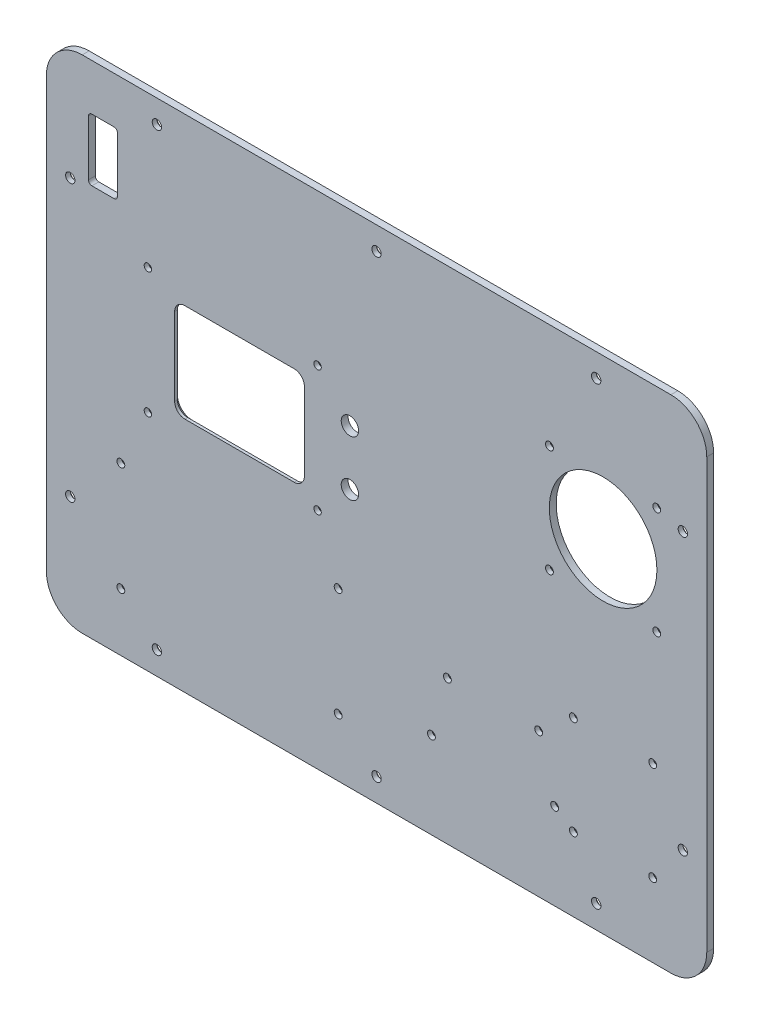
from build123d import *

# Parameters (mm, degrees)
BOSS_EXTRUDE1_DEPTH             = 3.175
F_6_CLEARANCE_HOLE1_AT_2_COUNT  = 2
F_6_CLEARANCE_HOLE1_AT_2_PITCH  = 202.184
F_6_CLEARANCE_HOLE1_AT_3_COUNT  = 2
F_6_CLEARANCE_HOLE1_AT_3_PITCH  = 245.533205315
F_6_CLEARANCE_HOLE1_AT_4_COUNT  = 2
F_6_CLEARANCE_HOLE1_AT_4_PITCH  = 294.732330958
F_6_CLEARANCE_HOLE1_AT_5_COUNT  = 2
F_6_CLEARANCE_HOLE1_AT_5_PITCH  = 209.296
F_6_CLEARANCE_HOLE1_AT_6_COUNT  = 2
F_6_CLEARANCE_HOLE1_AT_6_PITCH  = 172.811757411
F_6_CLEARANCE_HOLE1_AT_7_COUNT  = 2
F_6_CLEARANCE_HOLE1_AT_7_PITCH  = 57.300187604
F_6_CLEARANCE_HOLE1_AT_8_COUNT  = 2
F_6_CLEARANCE_HOLE1_AT_8_PITCH  = 291.003755082
F_6_CLEARANCE_HOLE1_AT_9_COUNT  = 2
F_6_CLEARANCE_HOLE1_AT_9_PITCH  = 232.431512666
F_6_CLEARANCE_HOLE1_AT_10_COUNT = 2
F_6_CLEARANCE_HOLE1_AT_10_PITCH = 101.092
SKETCH23_R                      = 24.765
CUT_EXTRUDE10_DEPTH             = 191.76187976
SKETCH24_W                      = 59.69
SKETCH24_H                      = 45.212
CUT_EXTRUDE11_DEPTH             = 191.76187976
FILLET2_R                       = 4.699
CHAMFER1_SIZE                   = 1.905
M3_CLEARANCE_HOLE3_AT_2_COUNT   = 2
M3_CLEARANCE_HOLE3_AT_2_PITCH   = 49.391408666
M3_CLEARANCE_HOLE3_AT_3_COUNT   = 2
M3_CLEARANCE_HOLE3_AT_3_PITCH   = 69.85
M3_CLEARANCE_HOLE3_AT_4_COUNT   = 2
M3_CLEARANCE_HOLE3_AT_4_PITCH   = 49.391408666
M3_CLEARANCE_HOLE1_D            = 3.6
M3_CLEARANCE_HOLE1_CSINK_D      = 5.7
M3_CLEARANCE_HOLE1_CSINK_ANGLE  = 90
M3_CLEARANCE_HOLE2_AT_2_COUNT   = 2
M3_CLEARANCE_HOLE2_AT_2_PITCH   = 56.70042
M3_CLEARANCE_HOLE2_AT_3_COUNT   = 2
M3_CLEARANCE_HOLE2_AT_3_PITCH   = 102.00589147
M3_CLEARANCE_HOLE2_AT_4_COUNT   = 2
M3_CLEARANCE_HOLE2_AT_4_PITCH   = 109.267844742
M3_CLEARANCE_HOLE2_AT_5_COUNT   = 2
M3_CLEARANCE_HOLE2_AT_5_PITCH   = 65.600653918
M3_CLEARANCE_HOLE2_AT_6_COUNT   = 2
M3_CLEARANCE_HOLE2_AT_6_PITCH   = 76.404880698
M3_CLEARANCE_HOLE2_AT_7_COUNT   = 2
M3_CLEARANCE_HOLE2_AT_7_PITCH   = 27.404059918
M3_CLEARANCE_HOLE2_AT_8_COUNT   = 2
M3_CLEARANCE_HOLE2_AT_8_PITCH   = 55.968061912
SKETCH35_W                      = 13.335
SKETCH35_H                      = 28.575
CUT_EXTRUDE12_DEPTH             = 191.76187976
FILLET1_R                       = 1.5875
F_8_0MM_DOWEL_HOLE1_D           = 8
M3_CLEARANCE_HOLE4_AT_2_COUNT   = 2
M3_CLEARANCE_HOLE4_AT_2_PITCH   = 78.105
M3_CLEARANCE_HOLE4_AT_3_COUNT   = 2
M3_CLEARANCE_HOLE4_AT_3_PITCH   = 97.157075141
M3_CLEARANCE_HOLE4_AT_4_COUNT   = 2
M3_CLEARANCE_HOLE4_AT_4_PITCH   = 57.785


with BuildPart() as part:
    # Sketch1 → Boss-Extrude1 (new body)
    with BuildSketch(Plane.XY):
        with BuildLine():
            Line((-151.96693, 98.7552), (-151.96693, -98.7552))
            ThreePointArc((-151.96693, -98.7552), (-147.131262957, -110.429532957), (-135.45693, -115.2652))
            Line((-135.45693, -115.2652), (135.45693, -115.2652))
            ThreePointArc((135.45693, -115.2652), (147.131262957, -110.429532957), (151.96693, -98.7552))
            Line((151.96693, -98.7552), (151.96693, 98.7552))
            ThreePointArc((151.96693, 98.7552), (147.131262957, 110.429532957), (135.45693, 115.2652))
            Line((135.45693, 115.2652), (-135.45693, 115.2652))
            ThreePointArc((-135.45693, 115.2652), (-147.131262957, 110.429532957), (-151.96693, 98.7552))
        make_face()
    extrude(amount=-BOSS_EXTRUDE1_DEPTH)

    # Sketch3 → #6 Clearance Hole1 (revolve, cut)
    with BuildSketch(Plane(origin=(101.092, 104.648, 0), x_dir=(0, -1, 0), z_dir=(1, 0, 0))):
        Polygon((0, 0), (0, 3.175), (3.3655, 3.175), (2.15265, 2.157298012), (2.15265, 0), align=None)
    f_6_clearance_hole1 = revolve(axis=Axis((101.092, 104.648, 6.35), (0, 0, -1)), mode=Mode.SUBTRACT)

    # #6 Clearance Hole1 at 2: #6 Clearance Hole1 ×2
    with Locations(*[(-i * F_6_CLEARANCE_HOLE1_AT_2_PITCH, 0, 0) for i in range(1, F_6_CLEARANCE_HOLE1_AT_2_COUNT)]):
        add(f_6_clearance_hole1, mode=Mode.SUBTRACT)

    # #6 Clearance Hole1 at 3: #6 Clearance Hole1 ×2
    with Locations(*[Vector(-0.9858574105677721, -0.1675862942743448, 0) * (i * F_6_CLEARANCE_HOLE1_AT_3_PITCH) for i in range(1, F_6_CLEARANCE_HOLE1_AT_3_COUNT)]):
        add(f_6_clearance_hole1, mode=Mode.SUBTRACT)

    # #6 Clearance Hole1 at 4: #6 Clearance Hole1 ×2
    with Locations(*[Vector(-0.8212900471859665, -0.5705108749123656, 0) * (i * F_6_CLEARANCE_HOLE1_AT_4_PITCH) for i in range(1, F_6_CLEARANCE_HOLE1_AT_4_COUNT)]):
        add(f_6_clearance_hole1, mode=Mode.SUBTRACT)

    # #6 Clearance Hole1 at 5: #6 Clearance Hole1 ×2
    with Locations(*[(0, -i * F_6_CLEARANCE_HOLE1_AT_5_PITCH, 0) for i in range(1, F_6_CLEARANCE_HOLE1_AT_5_COUNT)]):
        add(f_6_clearance_hole1, mode=Mode.SUBTRACT)

    # #6 Clearance Hole1 at 6: #6 Clearance Hole1 ×2
    with Locations(*[Vector(0.23075241289949347, -0.9730124993755537, 0) * (i * F_6_CLEARANCE_HOLE1_AT_6_PITCH) for i in range(1, F_6_CLEARANCE_HOLE1_AT_6_COUNT)]):
        add(f_6_clearance_hole1, mode=Mode.SUBTRACT)

    # #6 Clearance Hole1 at 7: #6 Clearance Hole1 ×2
    with Locations(*[Vector(0.6959266918172804, -0.7181128320927402, 0) * (i * F_6_CLEARANCE_HOLE1_AT_7_PITCH) for i in range(1, F_6_CLEARANCE_HOLE1_AT_7_COUNT)]):
        add(f_6_clearance_hole1, mode=Mode.SUBTRACT)

    # #6 Clearance Hole1 at 8: #6 Clearance Hole1 ×2
    with Locations(*[Vector(-0.6947814125038304, -0.719220959677332, 0) * (i * F_6_CLEARANCE_HOLE1_AT_8_PITCH) for i in range(1, F_6_CLEARANCE_HOLE1_AT_8_COUNT)]):
        add(f_6_clearance_hole1, mode=Mode.SUBTRACT)

    # #6 Clearance Hole1 at 9: #6 Clearance Hole1 ×2
    with Locations(*[Vector(-0.4349324187613887, -0.9004630981391565, 0) * (i * F_6_CLEARANCE_HOLE1_AT_9_PITCH) for i in range(1, F_6_CLEARANCE_HOLE1_AT_9_COUNT)]):
        add(f_6_clearance_hole1, mode=Mode.SUBTRACT)

    # #6 Clearance Hole1 at 10: #6 Clearance Hole1 ×2
    with Locations(*[(-i * F_6_CLEARANCE_HOLE1_AT_10_PITCH, 0, 0) for i in range(1, F_6_CLEARANCE_HOLE1_AT_10_COUNT)]):
        add(f_6_clearance_hole1, mode=Mode.SUBTRACT)

    # Sketch23 → Cut-Extrude10 (cut, through all)
    with BuildSketch(Plane.XY):
        with Locations((104.26573, 42.164)):
            Circle(SKETCH23_R)
    extrude(amount=-CUT_EXTRUDE10_DEPTH, mode=Mode.SUBTRACT)

    # Sketch24 → Cut-Extrude11 (cut, through all)
    with BuildSketch(Plane.XY):
        with Locations((-63.06693, 16.31442)):
            Rectangle(SKETCH24_W, SKETCH24_H)
    extrude(amount=-CUT_EXTRUDE11_DEPTH, mode=Mode.SUBTRACT)

    # Fillet2
    fillet2_edges = [part.edges().sort_by_distance(p)[0] for p in [
        (-92.91193, -6.29158, -1.5875),
        (-92.91193, 38.92042, -1.5875),
        (-33.22193, 38.92042, -1.5875),
        (-33.22193, -6.29158, -1.5875),
    ]]
    fillet(fillet2_edges, radius=FILLET2_R)

    # Chamfer1
    chamfer1_edges = [part.edges().sort_by_distance(p)[0] for p in [
        (-33.22193, 16.31442, -3.175),
        (-63.06693, -6.29158, -3.175),
        (-92.91193, 16.31442, -3.175),
        (-63.06693, 38.92042, -3.175),
        (-34.598235235, -4.915274765, -3.175),
        (-91.535624765, -4.915274765, -3.175),
        (-91.535624765, 37.544114765, -3.175),
        (-34.598235235, 37.544114765, -3.175),
    ]]
    chamfer(chamfer1_edges, length=CHAMFER1_SIZE)

    # Sketch30 → M3 Clearance Hole3 (revolve, cut)
    with BuildSketch(Plane(origin=(79.570025667, 66.859704333, 0), x_dir=(0, -1, 0), z_dir=(1, 0, 0))):
        Polygon((0, 0), (0, 3.175), (2.85, 3.175), (1.8, 2.125), (1.8, 0), align=None)
    m3_clearance_hole3 = revolve(axis=Axis((79.570025667, 66.859704333, 6.35), (0, 0, -1)), mode=Mode.SUBTRACT)

    # M3 Clearance Hole3 at 2: M3 Clearance Hole3 ×2
    with Locations(*[(i * M3_CLEARANCE_HOLE3_AT_2_PITCH, 0, 0) for i in range(1, M3_CLEARANCE_HOLE3_AT_2_COUNT)]):
        add(m3_clearance_hole3, mode=Mode.SUBTRACT)

    # M3 Clearance Hole3 at 3: M3 Clearance Hole3 ×2
    with Locations(*[Vector(0.7071067811865477, -0.7071067811865475, 0) * (i * M3_CLEARANCE_HOLE3_AT_3_PITCH) for i in range(1, M3_CLEARANCE_HOLE3_AT_3_COUNT)]):
        add(m3_clearance_hole3, mode=Mode.SUBTRACT)

    # M3 Clearance Hole3 at 4: M3 Clearance Hole3 ×2
    with Locations(*[(0, -i * M3_CLEARANCE_HOLE3_AT_4_PITCH, 0) for i in range(1, M3_CLEARANCE_HOLE3_AT_4_COUNT)]):
        add(m3_clearance_hole3, mode=Mode.SUBTRACT)

    # M3 Clearance Hole1 (through all)
    with Locations(Plane(origin=(0, 0, -3.175), x_dir=(-1, 0, 0), z_dir=(0, 0, -1))):
        with Locations((17.67693, -38.5952), (117.67693, -38.5952), (117.67693, -88.5952), (17.67693, -88.5952)):
            CounterSinkHole(M3_CLEARANCE_HOLE1_D / 2, M3_CLEARANCE_HOLE1_CSINK_D / 2, counter_sink_angle=M3_CLEARANCE_HOLE1_CSINK_ANGLE)

    # Sketch34 → M3 Clearance Hole2 (revolve, cut)
    with BuildSketch(Plane(origin=(25.25193, -75.5297, 0), x_dir=(0, -1, 0), z_dir=(1, 0, 0))):
        Polygon((0, 0), (0, 3.175), (2.85, 3.175), (1.8, 2.125), (1.8, 0), align=None)
    m3_clearance_hole2 = revolve(axis=Axis((25.25193, -75.5297, 6.35), (0, 0, -1)), mode=Mode.SUBTRACT)

    # M3 Clearance Hole2 at 2: M3 Clearance Hole2 ×2
    with Locations(*[(i * M3_CLEARANCE_HOLE2_AT_2_PITCH, 0, 0) for i in range(1, M3_CLEARANCE_HOLE2_AT_2_COUNT)]):
        add(m3_clearance_hole2, mode=Mode.SUBTRACT)

    # M3 Clearance Hole2 at 3: M3 Clearance Hole2 ×2
    with Locations(*[Vector(0.9983315525499471, -0.05774176290357108, 0) * (i * M3_CLEARANCE_HOLE2_AT_3_PITCH) for i in range(1, M3_CLEARANCE_HOLE2_AT_3_COUNT)]):
        add(m3_clearance_hole2, mode=Mode.SUBTRACT)

    # M3 Clearance Hole2 at 4: M3 Clearance Hole2 ×2
    with Locations(*[Vector(0.9319823250907686, 0.36250371821321364, 0) * (i * M3_CLEARANCE_HOLE2_AT_4_PITCH) for i in range(1, M3_CLEARANCE_HOLE2_AT_4_COUNT)]):
        add(m3_clearance_hole2, mode=Mode.SUBTRACT)

    # M3 Clearance Hole2 at 5: M3 Clearance Hole2 ×2
    with Locations(*[Vector(0.9959611085814934, -0.089785690358334, 0) * (i * M3_CLEARANCE_HOLE2_AT_5_PITCH) for i in range(1, M3_CLEARANCE_HOLE2_AT_5_COUNT)]):
        add(m3_clearance_hole2, mode=Mode.SUBTRACT)

    # M3 Clearance Hole2 at 6: M3 Clearance Hole2 ×2
    with Locations(*[Vector(0.8551246910281444, 0.5184223787550272, 0) * (i * M3_CLEARANCE_HOLE2_AT_6_PITCH) for i in range(1, M3_CLEARANCE_HOLE2_AT_6_COUNT)]):
        add(m3_clearance_hole2, mode=Mode.SUBTRACT)

    # M3 Clearance Hole2 at 7: M3 Clearance Hole2 ×2
    with Locations(*[Vector(0.2682084341495708, 0.9633609063331537, 0) * (i * M3_CLEARANCE_HOLE2_AT_7_PITCH) for i in range(1, M3_CLEARANCE_HOLE2_AT_7_COUNT)]):
        add(m3_clearance_hole2, mode=Mode.SUBTRACT)

    # M3 Clearance Hole2 at 8: M3 Clearance Hole2 ×2
    with Locations(*[Vector(0.8817603882311722, 0.47169759141468215, 0) * (i * M3_CLEARANCE_HOLE2_AT_8_PITCH) for i in range(1, M3_CLEARANCE_HOLE2_AT_8_COUNT)]):
        add(m3_clearance_hole2, mode=Mode.SUBTRACT)

    # Sketch35 → Cut-Extrude12 (cut, through all)
    with BuildSketch(Plane.XY):
        with Locations((-125.93193, 79.5782)):
            Rectangle(SKETCH35_W, SKETCH35_H)
    extrude(amount=-CUT_EXTRUDE12_DEPTH, mode=Mode.SUBTRACT)

    # Fillet1
    fillet1_edges = [part.edges().sort_by_distance(p)[0] for p in [
        (-132.59943, 65.2907, -1.5875),
        (-132.59943, 93.8657, -1.5875),
        (-119.26443, 93.8657, -1.5875),
        (-119.26443, 65.2907, -1.5875),
    ]]
    fillet(fillet1_edges, radius=FILLET1_R)

    # Ø8.0mm Dowel Hole1 (through all)
    with Locations(Plane(origin=(0, 0, -3.175), x_dir=(-1, 0, 0), z_dir=(0, 0, -1))):
        with Locations((12.26693, 3.61442), (12.26693, 29.01442)):
            Hole(F_8_0MM_DOWEL_HOLE1_D / 2)

    # Sketch39 → M3 Clearance Hole4 (revolve, cut)
    with BuildSketch(Plane(origin=(-105.23093, 45.65142, 0), x_dir=(0, -1, 0), z_dir=(1, 0, 0))):
        Polygon((0, 0), (0, 3.175), (2.85, 3.175), (1.7, 2.025), (1.7, 0), align=None)
    m3_clearance_hole4 = revolve(axis=Axis((-105.23093, 45.65142, 6.35), (0, 0, -1)), mode=Mode.SUBTRACT)

    # M3 Clearance Hole4 at 2: M3 Clearance Hole4 ×2
    with Locations(*[(i * M3_CLEARANCE_HOLE4_AT_2_PITCH, 0, 0) for i in range(1, M3_CLEARANCE_HOLE4_AT_2_COUNT)]):
        add(m3_clearance_hole4, mode=Mode.SUBTRACT)

    # M3 Clearance Hole4 at 3: M3 Clearance Hole4 ×2
    with Locations(*[Vector(0.8039043979705941, -0.5947585383359678, 0) * (i * M3_CLEARANCE_HOLE4_AT_3_PITCH) for i in range(1, M3_CLEARANCE_HOLE4_AT_3_COUNT)]):
        add(m3_clearance_hole4, mode=Mode.SUBTRACT)

    # M3 Clearance Hole4 at 4: M3 Clearance Hole4 ×2
    with Locations(*[(0, -i * M3_CLEARANCE_HOLE4_AT_4_PITCH, 0) for i in range(1, M3_CLEARANCE_HOLE4_AT_4_COUNT)]):
        add(m3_clearance_hole4, mode=Mode.SUBTRACT)


solid = part.part
